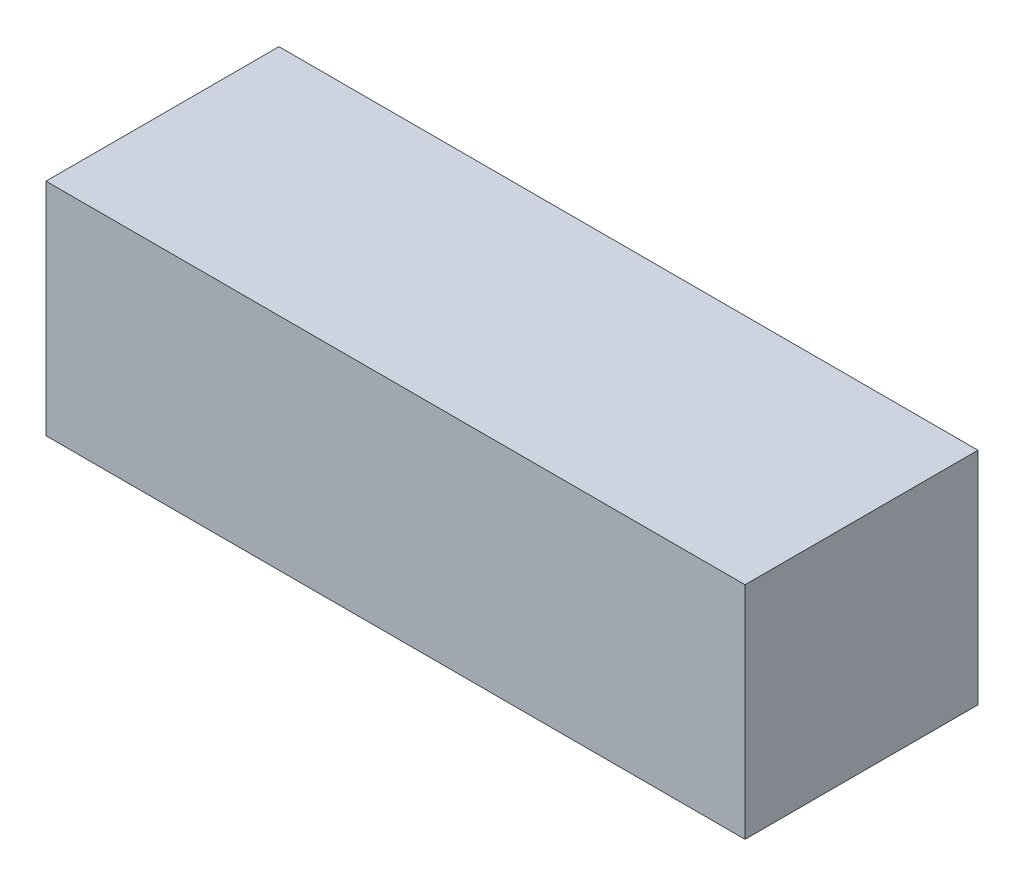
from build123d import *

# Parameters (mm, degrees)
SKETCH1_W           = 42.327187554
SKETCH1_H           = 40.059659649
BOSS_EXTRUDE1_DEPTH = 127


with BuildPart() as part:
    # Sketch1 → Boss-Extrude1 (new body)
    with BuildSketch(Plane(origin=(0, 0, 0), x_dir=(0, 0, -1), z_dir=(1, 0, 0))):
        with Locations((8.465437511, -4.53505581)):
            Rectangle(SKETCH1_W, SKETCH1_H)
    extrude(amount=BOSS_EXTRUDE1_DEPTH)


solid = part.part
